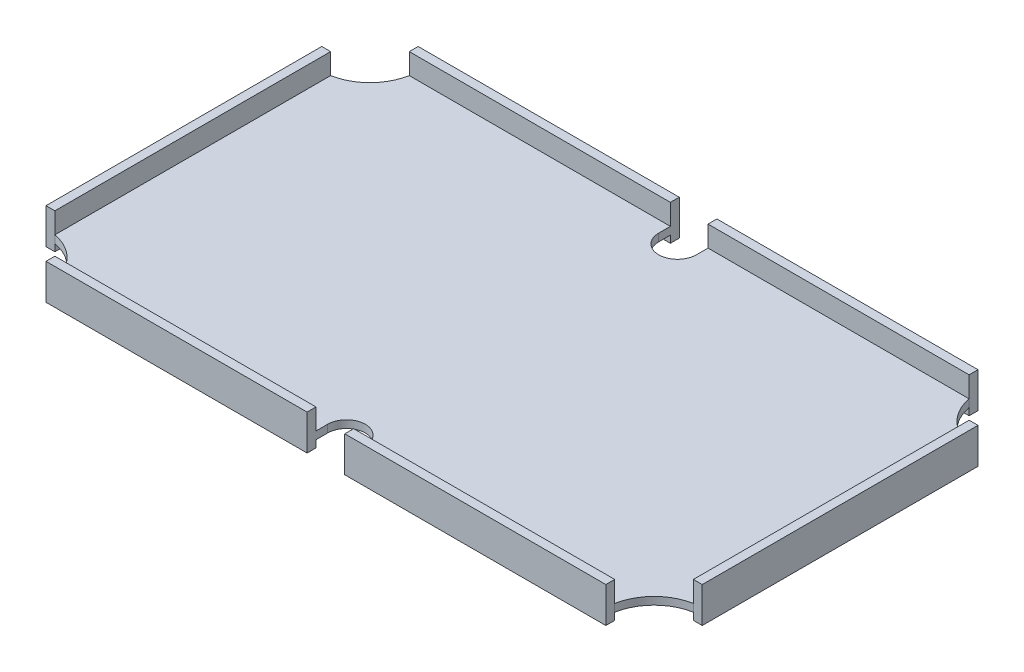
from build123d import *

# Parameters (mm, degrees)
CROQUIS1_W              = 92.4
CROQUIS1_H              = 52.4
SALIENTE_EXTRUIR1_DEPTH = 5
CROQUIS2_W              = 89.9
CROQUIS2_H              = 49.9
CORTAR_EXTRUIR1_DEPTH   = 2.93
CORTAR_EXTRUIR2_START   = -2.07
CORTAR_EXTRUIR2_DEPTH   = 5
CORTAR_EXTRUIR3_START   = -2.07
CORTAR_EXTRUIR3_DEPTH   = 5
SIMETR_A2_START         = -2.07
SIMETR_A2_COPY_1_DEPTH  = 5
CORTAR_EXTRUIR5_DEPTH   = 1
CROQUIS7_W              = 89.9
CROQUIS7_H              = 4.51
SALIENTE_EXTRUIR2_DEPTH = 1.24


with BuildPart() as part:
    # Croquis1 → Saliente-Extruir1 (new body)
    with BuildSketch(Plane(origin=(0, 0, 0), x_dir=(1, 0, 0), z_dir=(0, 1, 0))):
        Rectangle(CROQUIS1_W, CROQUIS1_H)
    extrude(amount=SALIENTE_EXTRUIR1_DEPTH)

    # Croquis2 → Cortar-Extruir1 (cut)
    with BuildSketch(Plane(origin=(0, 5, 0), x_dir=(1, 0, 0), z_dir=(0, 1, 0))):
        Rectangle(CROQUIS2_W, CROQUIS2_H)
    extrude(amount=-CORTAR_EXTRUIR1_DEPTH, mode=Mode.SUBTRACT)

    # Croquis3 → Cortar-Extruir2 (cut)
    with BuildSketch(Plane(origin=(0, 2.07, 0), x_dir=(1, 0, 0), z_dir=(0, 1, 0)).offset(CORTAR_EXTRUIR2_START)):
        with BuildLine():
            Line((2.65, -23.31), (2.65, -26.2))
            Line((2.65, -26.2), (-2.65, -26.2))
            Line((-2.65, -26.2), (-2.65, -23.31))
            ThreePointArc((-2.65, -23.31), (0, -20.66), (2.65, -23.31))
        make_face()
    cortar_extruir2 = extrude(amount=CORTAR_EXTRUIR2_DEPTH, mode=Mode.SUBTRACT)

    # Croquis4 → Cortar-Extruir3 (cut)
    with BuildSketch(Plane(origin=(0, 2.07, 0), x_dir=(1, 0, 0), z_dir=(0, 1, 0)).offset(CORTAR_EXTRUIR3_START)):
        with BuildLine():
            Line((-46.2, -19.414169174), (-46.2, -26.2))
            Line((-46.2, -26.2), (-39.414169174, -26.2))
            Line((-39.414169174, -26.2), (-39.414169174, -24.95))
            ThreePointArc((-39.414169174, -24.95), (-41.32096321, -21.32096321), (-44.95, -19.414169174))
            Line((-44.95, -19.414169174), (-46.2, -19.414169174))
        make_face()
    cortar_extruir3 = extrude(amount=CORTAR_EXTRUIR3_DEPTH, mode=Mode.SUBTRACT)

    # Simetría1: Cortar-Extruir3 across plane
    add(cortar_extruir3.mirror(Plane(origin=(0, 0, 0), x_dir=(0, 0, 1), z_dir=(1, 0, 0))), mode=Mode.SUBTRACT)

    # Simetría2: Cortar-Extruir3 across plane
    add(cortar_extruir3.mirror(Plane.XY), mode=Mode.SUBTRACT)

    # Simetría2 copy 1 sketch → Simetría2 copy 1 (cut)
    with BuildSketch(Plane(origin=(0, 2.07, 0), x_dir=(-1, 0, 0), z_dir=(0, 1, 0)).offset(SIMETR_A2_START)):
        with BuildLine():
            Line((-46.2, -19.414169174), (-46.2, -26.2))
            Line((-46.2, -26.2), (-39.414169174, -26.2))
            Line((-39.414169174, -26.2), (-39.414169174, -24.95))
            ThreePointArc((-39.414169174, -24.95), (-41.32096321, -21.32096321), (-44.95, -19.414169174))
            Line((-44.95, -19.414169174), (-46.2, -19.414169174))
        make_face()
    extrude(amount=SIMETR_A2_COPY_1_DEPTH, mode=Mode.SUBTRACT)

    # Simetría3: Cortar-Extruir2 across plane
    add(cortar_extruir2.mirror(Plane.XY), mode=Mode.SUBTRACT)

    # Croquis6 → Cortar-Extruir5 (cut)
    with BuildSketch(Plane.XZ):
        with BuildLine():
            Line((2.65, -24.95), (3.9, -24.95))
            Line((3.9, -24.95), (38.164169174, -24.95))
            Line((38.164169174, -24.95), (39.414169174, -24.95))
            ThreePointArc((39.414169174, -24.95), (41.32096321, -21.32096321), (44.95, -19.414169174))
            Line((44.95, -19.414169174), (44.95, -18.164169174))
            Line((44.95, -18.164169174), (44.95, 18.164169174))
            Line((44.95, 18.164169174), (44.95, 19.414169174))
            ThreePointArc((44.95, 19.414169174), (41.32096321, 21.32096321), (39.414169174, 24.95))
            Line((39.414169174, 24.95), (38.164169174, 24.95))
            Line((38.164169174, 24.95), (3.9, 24.95))
            Line((3.9, 24.95), (2.65, 24.95))
            Line((2.65, 24.95), (2.65, 23.31))
            ThreePointArc((2.65, 23.31), (0, 20.66), (-2.65, 23.31))
            Line((-2.65, 23.31), (-2.65, 24.95))
            Line((-2.65, 24.95), (-3.9, 24.95))
            Line((-3.9, 24.95), (-38.164169174, 24.95))
            Line((-38.164169174, 24.95), (-39.414169174, 24.95))
            ThreePointArc((-39.414169174, 24.95), (-41.32096321, 21.32096321), (-44.95, 19.414169174))
            Line((-44.95, 19.414169174), (-44.95, 18.164169174))
            Line((-44.95, 18.164169174), (-44.95, -18.164169174))
            Line((-44.95, -18.164169174), (-44.95, -19.414169174))
            ThreePointArc((-44.95, -19.414169174), (-41.32096321, -21.32096321), (-39.414169174, -24.95))
            Line((-39.414169174, -24.95), (-38.164169174, -24.95))
            Line((-38.164169174, -24.95), (-3.9, -24.95))
            Line((-3.9, -24.95), (-2.65, -24.95))
            Line((-2.65, -24.95), (-2.65, -23.31))
            ThreePointArc((-2.65, -23.31), (0, -20.66), (2.65, -23.31))
            Line((2.65, -23.31), (2.65, -24.95))
        make_face()
    extrude(amount=-CORTAR_EXTRUIR5_DEPTH, mode=Mode.SUBTRACT)

    # Croquis7 → Saliente-Extruir2 (add)
    with BuildSketch(Plane.XZ.offset(-1)):
        with Locations((0, -14.565)):
            Rectangle(CROQUIS7_W, CROQUIS7_H)
    saliente_extruir2 = extrude(amount=SALIENTE_EXTRUIR2_DEPTH)

    # Simetría4: Saliente-Extruir2 across plane
    add(saliente_extruir2.mirror(Plane.XY))


solid = part.part
